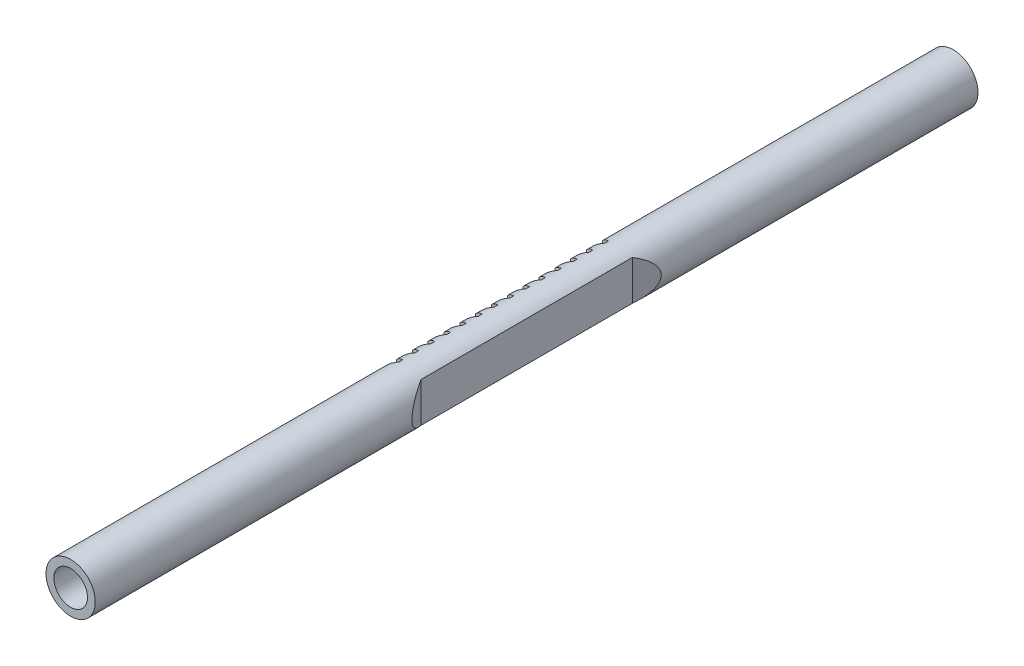
from build123d import *

# Parameters (mm, degrees)
SKETCH1_R               = 10.4275
BOSS_EXTRUDE1_DEPTH     = 390
SKETCH2_R               = 7.112
CUT_EXTRUDE1_DEPTH      = 141.75
CUT_EXTRUDE2_START      = -141.75
SKETCH3_R               = 7.112
CUT_EXTRUDE2_DEPTH      = 141.75
CUT_EXTRUDE3_DEPTH      = 20
CUT_EXTRUDE3_DEPTH_BACK = 20
SKETCH4_W               = 2.8
SKETCH4_H               = 97.6
CUT_EXTRUDE4_DEPTH      = 20
LPATTERN1_COUNT         = 14
LPATTERN1_PITCH         = 6.7
SKETCH6_W               = 24.776384874
SKETCH6_H               = 25.11648024
CUT_EXTRUDE5_DEPTH      = 8.25
SKETCH7_W               = 32.905320966
SKETCH7_H               = 32.372251486
CUT_EXTRUDE6_DEPTH      = 8.25


with BuildPart() as part:
    # Sketch1 → Boss-Extrude1 (new body)
    with BuildSketch(Plane.XY):
        Circle(SKETCH1_R)
    extrude(amount=BOSS_EXTRUDE1_DEPTH)

    # Sketch2 → Cut-Extrude1 (cut)
    with BuildSketch(Plane(origin=(0, 0, 0), x_dir=(-1, 0, 0), z_dir=(0, 0, -1))):
        Circle(SKETCH2_R)
    extrude(amount=-CUT_EXTRUDE1_DEPTH, mode=Mode.SUBTRACT)

    # Sketch3 → Cut-Extrude2 (cut)
    with BuildSketch(Plane.XY.offset(390).offset(CUT_EXTRUDE2_START)):
        Circle(SKETCH3_R)
    extrude(amount=CUT_EXTRUDE2_DEPTH, mode=Mode.SUBTRACT)

    # Sketch4 → Cut-Extrude3 (cut, two sides: drawn at the far end of the back side and taken through both)
    with BuildSketch(Plane(origin=(0, 0, 0), x_dir=(1, 0, 0), z_dir=(0, 1, 0)).offset(-CUT_EXTRUDE3_DEPTH_BACK)):
        Polygon((6.189444989, -239.775), (6.189444989, -150.245179393), (10.438224829, -142.247476164), (10.438224829, -247.772703229), align=None)
        with Locations((-9.0275, -195.025)):
            Rectangle(SKETCH4_W, SKETCH4_H)
    extrude(amount=CUT_EXTRUDE3_DEPTH + CUT_EXTRUDE3_DEPTH_BACK, mode=Mode.SUBTRACT)

    # Sketch5 → Cut-Extrude4 (cut, symmetric)
    with BuildSketch(Plane(origin=(0, 0, 0), x_dir=(1, 0, 0), z_dir=(0, 1, 0))):
        Polygon((-3.4275, -152.275), (-3.4275, -150.675), (-7.6275, -149.175), (-7.6275, -153.775), align=None)
    cut_extrude4 = extrude(amount=CUT_EXTRUDE4_DEPTH, both=True, mode=Mode.SUBTRACT)

    # LPattern1: Cut-Extrude4 ×14
    with Locations(*[(0, 0, i * LPATTERN1_PITCH) for i in range(1, LPATTERN1_COUNT)]):
        add(cut_extrude4, mode=Mode.SUBTRACT)

    # Sketch6 → Cut-Extrude5 (cut)
    with BuildSketch(Plane.XY.offset(390)):
        Rectangle(SKETCH6_W, SKETCH6_H)
    extrude(amount=-CUT_EXTRUDE5_DEPTH, mode=Mode.SUBTRACT)

    # Sketch7 → Cut-Extrude6 (cut)
    with BuildSketch(Plane(origin=(0, 0, 0), x_dir=(-1, 0, 0), z_dir=(0, 0, -1))):
        Rectangle(SKETCH7_W, SKETCH7_H)
    extrude(amount=-CUT_EXTRUDE6_DEPTH, mode=Mode.SUBTRACT)


solid = part.part
